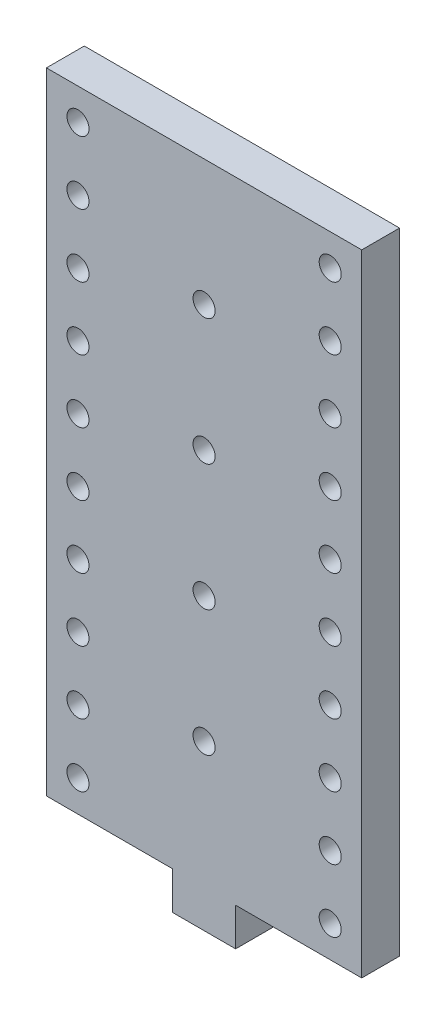
from build123d import *

# Parameters (mm, degrees)
ESBO_O1_W                  = 50
ESBO_O1_H                  = 100
RESSALTO_EXTRUS_O1_DEPTH   = 6
CORTE_EXTRUS_O1_DEPTH      = 105.394009728
CORTE_EXTRUS_O1_DEPTH_BACK = 105.394009728
ESBO_O2_R                  = 1.75
ESBO_O3_R                  = 1.75
CORTE_EXTRUS_O2_DEPTH      = 105.394009728
ESBO_O4_W                  = 10
ESBO_O4_H                  = 6
RESSALTO_EXTRUS_O2_DEPTH   = 6


with BuildPart() as part:
    # Esboço1 → Ressalto-extrusão1 (new body)
    with BuildSketch(Plane.XY):
        with Locations((-4.361697279, 50)):
            Rectangle(ESBO_O1_W, ESBO_O1_H)
    extrude(amount=RESSALTO_EXTRUS_O1_DEPTH)

    # Esboço2 → Corte-extrusão1 (cut, two sides: drawn at the far end of the back side and taken through both)
    with BuildSketch(Plane.XY.offset(6).offset(-CORTE_EXTRUS_O1_DEPTH_BACK)):
        with Locations((-24.361697279, 95)):
            Circle(ESBO_O2_R)
        with Locations((-24.361697279, 85)):
            Circle(ESBO_O2_R)
        with Locations((-24.361697279, 75)):
            Circle(ESBO_O2_R)
        with Locations((-24.361697279, 65)):
            Circle(ESBO_O2_R)
        with Locations((-24.361697279, 55)):
            Circle(ESBO_O2_R)
        with Locations((-24.361697279, 45)):
            Circle(ESBO_O2_R)
        with Locations((-24.361697279, 35)):
            Circle(ESBO_O2_R)
        with Locations((-24.361697279, 25)):
            Circle(ESBO_O2_R)
        with Locations((-24.361697279, 15)):
            Circle(ESBO_O2_R)
        with Locations((-24.361697279, 5)):
            Circle(ESBO_O2_R)
        with Locations((15.638302721, 95)):
            Circle(ESBO_O2_R)
        with Locations((15.638302721, 85)):
            Circle(ESBO_O2_R)
        with Locations((15.638302721, 75)):
            Circle(ESBO_O2_R)
        with Locations((15.638302721, 65)):
            Circle(ESBO_O2_R)
        with Locations((15.638302721, 55)):
            Circle(ESBO_O2_R)
        with Locations((15.638302721, 45)):
            Circle(ESBO_O2_R)
        with Locations((15.638302721, 35)):
            Circle(ESBO_O2_R)
        with Locations((15.638302721, 25)):
            Circle(ESBO_O2_R)
        with Locations((15.638302721, 15)):
            Circle(ESBO_O2_R)
        with Locations((15.638302721, 5)):
            Circle(ESBO_O2_R)
    extrude(amount=CORTE_EXTRUS_O1_DEPTH + CORTE_EXTRUS_O1_DEPTH_BACK, mode=Mode.SUBTRACT)

    # Esboço3 → Corte-extrusão2 (cut, through all)
    with BuildSketch(Plane.XY.offset(6)):
        with Locations((-4.361697279, 80)):
            Circle(ESBO_O3_R)
        with Locations((-4.361697279, 60)):
            Circle(ESBO_O3_R)
        with Locations((-4.361697279, 40)):
            Circle(ESBO_O3_R)
        with Locations((-4.361697279, 20)):
            Circle(ESBO_O3_R)
    extrude(amount=-CORTE_EXTRUS_O2_DEPTH, mode=Mode.SUBTRACT)

    # Esboço4 → Ressalto-extrusão2 (add)
    with BuildSketch(Plane(origin=(0, 0, 0), x_dir=(-1, 0, 0), z_dir=(0, -1, 0))):
        with Locations((4.361697279, -3)):
            Rectangle(ESBO_O4_W, ESBO_O4_H)
    extrude(amount=RESSALTO_EXTRUS_O2_DEPTH)


solid = part.part
